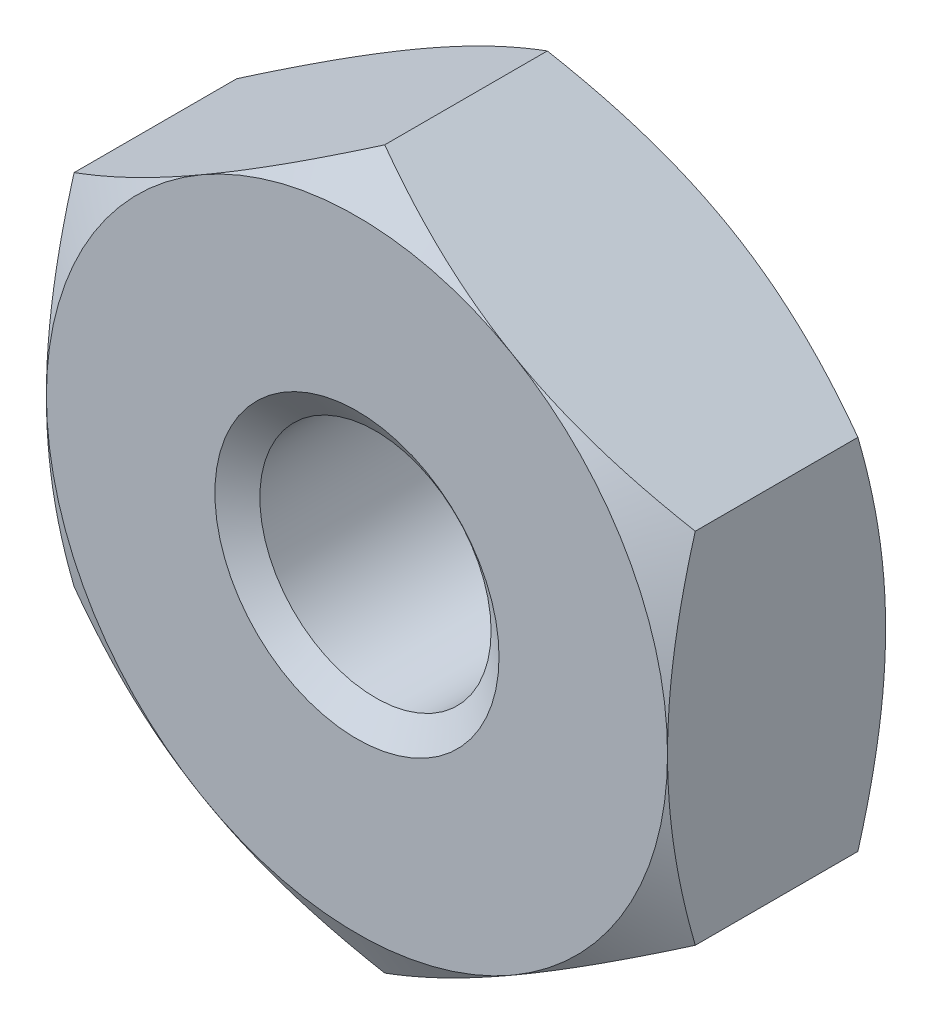
from build123d import *

# Parameters (mm, degrees)
BASENUTSKE_R  = 0.889
BASENUT_DEPTH = 1.6764


with BuildPart() as part:
    # BaseNutSke → BaseNut (new body)
    with BuildSketch(Plane.XY):
        Polygon((2.3876, 1.378481503), (2.3876, -1.378481503), (0, -2.756963005), (-2.3876, -1.378481503), (-2.3876, 1.378481503), (0, 2.756963005), align=None)
        Circle(BASENUTSKE_R, mode=Mode.SUBTRACT)
    extrude(amount=-BASENUT_DEPTH)

    # Sketch3 → Double-Chamfer (revolve, cut)
    with BuildSketch(Plane(origin=(0, 0, 0), x_dir=(0, 0, -1), z_dir=(1, 0, 0))):
        Polygon((1.6764, 2.3876), (1.463148169, 2.756963005), (1.463148169, 15.456963005), (14.3764, 15.456963005), (14.3764, 2.3876), align=None)
        Polygon((0.213251831, 15.456963005), (-12.7, 15.456963005), (-12.7, 2.3876), (0, 2.3876), (0.213251831, 2.756963005), align=None)
    revolve(axis=Axis((0, 0, 0), (0, 0, -1)), mode=Mode.SUBTRACT)

    # EndChamferSketch → EndChamfer (revolve, cut)
    with BuildSketch(Plane(origin=(0, 0, 0), x_dir=(0, 0, -1), z_dir=(1, 0, 0)), mode=Mode.PRIVATE) as endchamfer_sk:
        Polygon((1.651, 1.0922), (1.494489611, 0.86868), (1.7018, 0.86868), (1.7018, 1.0922), align=None)
        Polygon((-0.0508, 1.0922), (0, 1.0922), (0.156510389, 0.86868), (-0.0508, 0.86868), align=None)
    revolve(endchamfer_sk.sketch.rotate(Axis((0, 0, -25.037505729), (0, 0, -1)), 90), axis=Axis((0, 0, -25.037505729), (0, 0, -1)), mode=Mode.SUBTRACT)


solid = part.part
